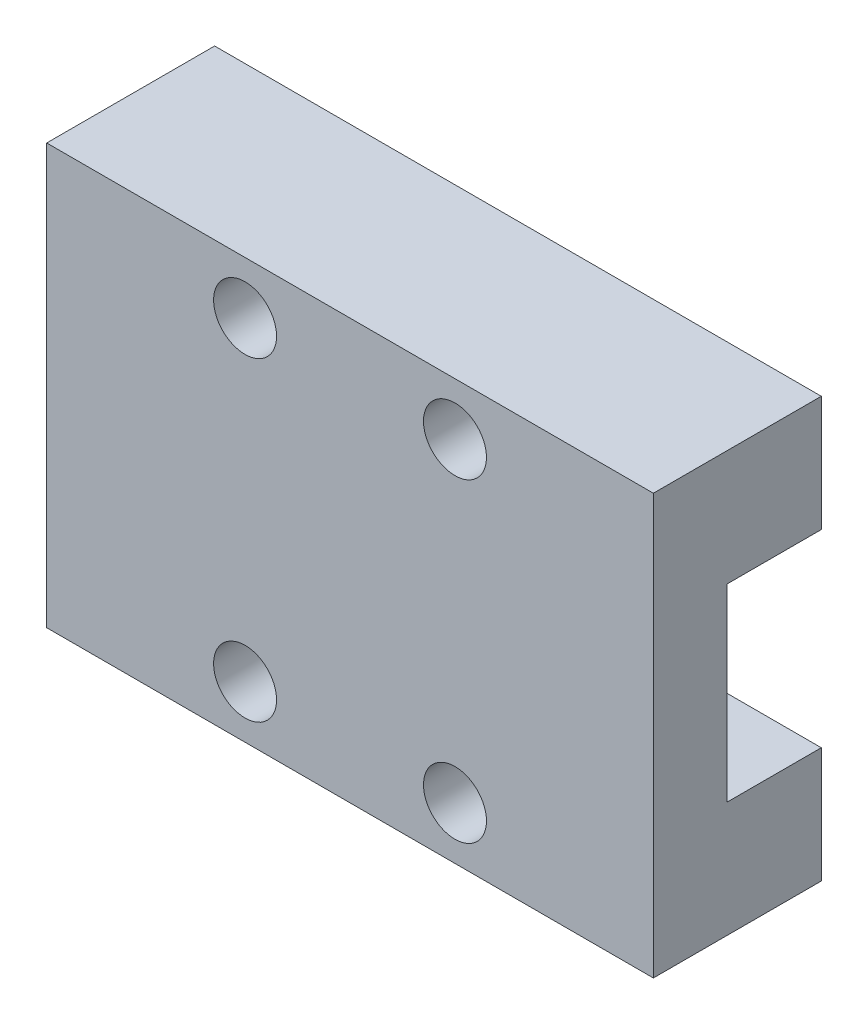
from build123d import *

# Parameters (mm, degrees)
SKETCH_1_W          = 28.9
SKETCH_1_H          = 20
EXTRUDE_1_DEPTH     = 8
SKETCH_2_W          = 28.9
SKETCH_2_H          = 9
CUT_EXTRUDE_1_DEPTH = 4.5
SKETCH_3_R          = 1.5
CUT_EXTRUDE_2_DEPTH = 3


with BuildPart() as part:
    # 草图1 → 凸台-拉伸1 (new body)
    with BuildSketch(Plane.XY):
        Rectangle(SKETCH_1_W, SKETCH_1_H)
    extrude(amount=EXTRUDE_1_DEPTH)

    # 草图2 → 切除-拉伸1 (cut)
    with BuildSketch(Plane(origin=(0, 0, 0), x_dir=(-1, 0, 0), z_dir=(0, 0, -1))):
        Rectangle(SKETCH_2_W, SKETCH_2_H)
    extrude(amount=-CUT_EXTRUDE_1_DEPTH, mode=Mode.SUBTRACT)

    # 草图3 → 切除-拉伸2 (cut)
    with BuildSketch(Plane.XY.offset(8)):
        with Locations((-5, 7.5)):
            Circle(SKETCH_3_R)
        with Locations(Location((-5, -7.5, 0), (0, 0, 180))):
            Circle(SKETCH_3_R)
        with Locations(Location((5, 7.5, 0), (0, 0, 180))):
            Circle(SKETCH_3_R)
        with Locations((5, -7.5)):
            Circle(SKETCH_3_R)
    extrude(amount=-CUT_EXTRUDE_2_DEPTH, mode=Mode.SUBTRACT)


solid = part.part
